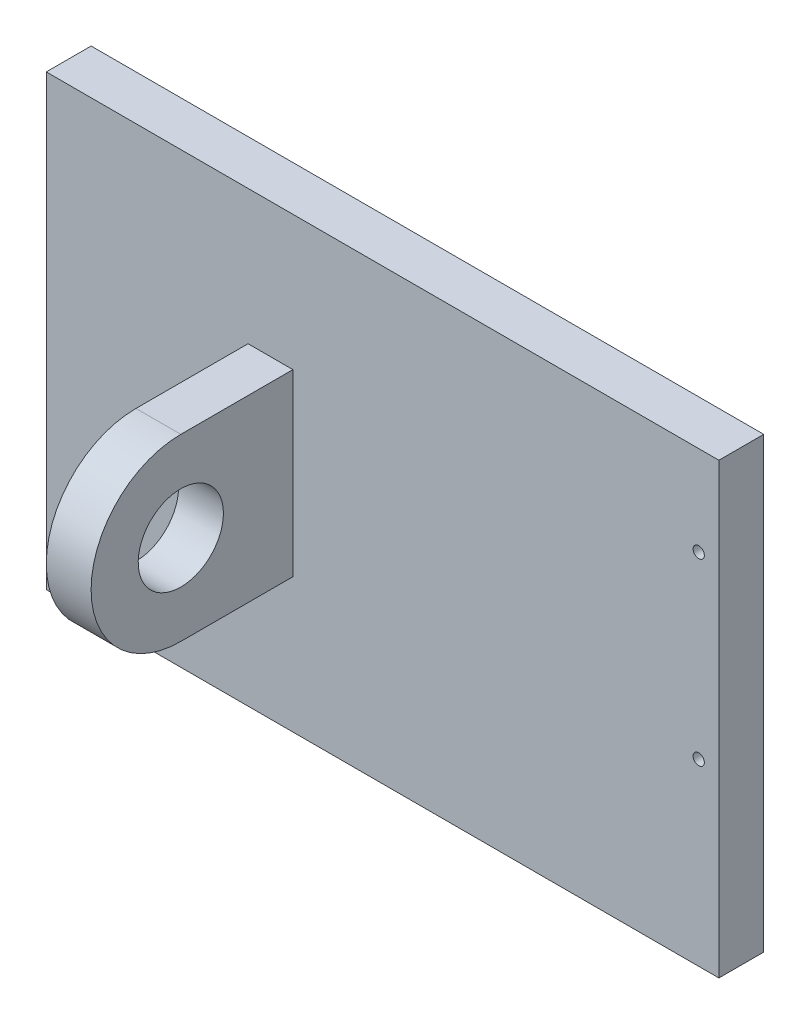
from build123d import *

# Parameters (mm, degrees)
SKETCH_2_W          = 150
SKETCH_2_H          = 100
EXTRUDE_1_DEPTH     = 10
SKETCH_3_W          = 10
SKETCH_3_H          = 40
EXTRUDE_2_DEPTH     = 35
SKETCH_4_R          = 20
EXTRUDE_3_DEPTH     = 10
SKETCH_5_R          = 9.5
CUT_EXTRUDE_1_DEPTH = 10
M3X0_5_2_D          = 2.5


with BuildPart() as part:
    # ｽｹｯﾁ2 → ﾎﾞｽ - 押し出し1 (new body)
    with BuildSketch(Plane.XY):
        Rectangle(SKETCH_2_W, SKETCH_2_H)
    extrude(amount=EXTRUDE_1_DEPTH)

    # ｽｹｯﾁ3 → ﾎﾞｽ - 押し出し2 (add)
    with BuildSketch(Plane.XY):
        with Locations((-25, 0)):
            Rectangle(SKETCH_3_W, SKETCH_3_H)
    extrude(amount=EXTRUDE_2_DEPTH)

    # ｽｹｯﾁ4 → ﾎﾞｽ - 押し出し3 (add)
    with BuildSketch(Plane.ZY.offset(30)):
        with Locations((35, 0)):
            Circle(SKETCH_4_R)
    extrude(amount=-EXTRUDE_3_DEPTH)

    # ｽｹｯﾁ5 → ｶｯﾄ - 押し出し1 (cut)
    with BuildSketch(Plane.ZY.offset(30)):
        with Locations(Location((35, 0, 0), (0, 0, 270))):
            Circle(SKETCH_5_R)
    extrude(amount=-CUT_EXTRUDE_1_DEPTH, mode=Mode.SUBTRACT)

    # M3x0.5 ねじ穴2 (through all)
    with Locations(Plane.XY.offset(10)):
        with Locations((70.5, -10.000898701), (70.5, 29.999101299)):
            Hole(M3X0_5_2_D / 2)


solid = part.part
